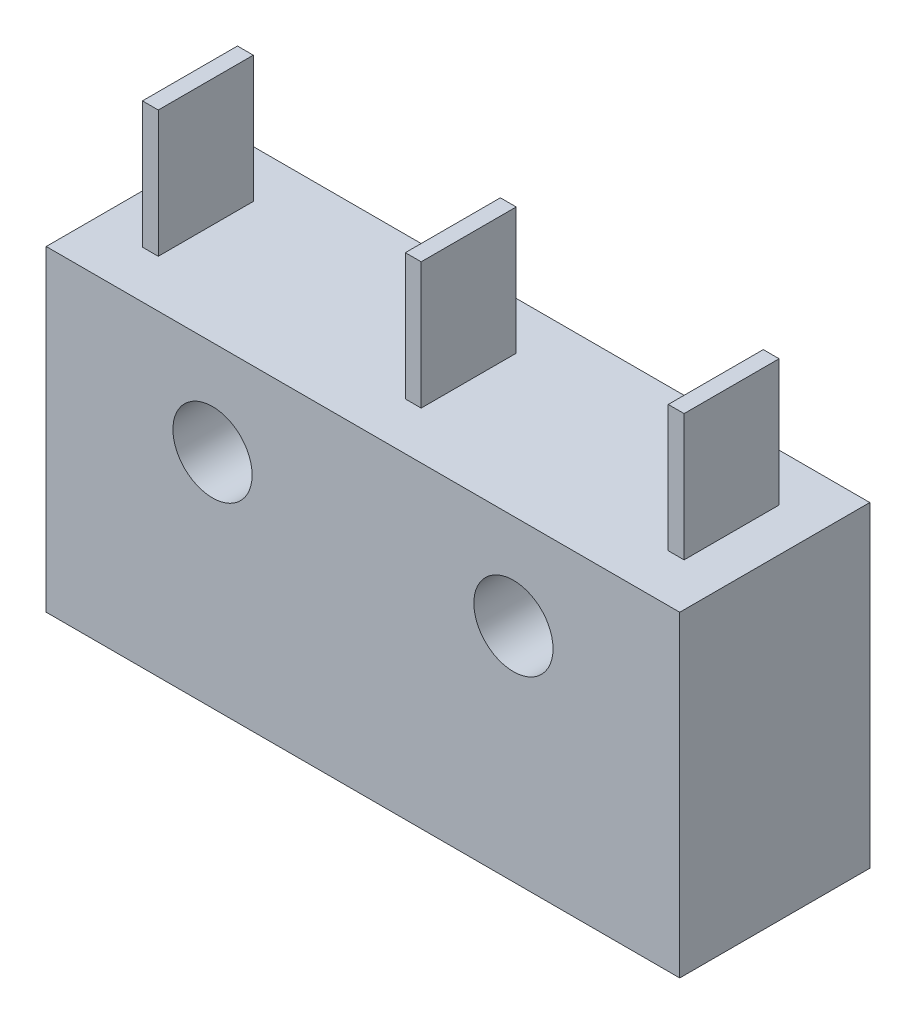
from build123d import *

# Parameters (mm, degrees)
SKETCH1_W           = 20
SKETCH1_H           = 10
BOSS_EXTRUDE1_DEPTH = 6
SKETCH2_W           = 0.5
SKETCH2_H           = 3
BOSS_EXTRUDE2_DEPTH = 4
SKETCH3_R           = 1.25
CUT_EXTRUDE1_DEPTH  = 15.730919863


with BuildPart() as part:
    # Sketch1 → Boss-Extrude1 (new body)
    with BuildSketch(Plane.XY):
        Rectangle(SKETCH1_W, SKETCH1_H)
    extrude(amount=BOSS_EXTRUDE1_DEPTH)

    # Sketch2 → Boss-Extrude2 (add)
    with BuildSketch(Plane(origin=(0, 5, 0), x_dir=(1, 0, 0), z_dir=(0, 1, 0))):
        with Locations((-8.212529155, -3)):
            Rectangle(SKETCH2_W, SKETCH2_H)
        with Locations((0.087470845, -3)):
            Rectangle(SKETCH2_W, SKETCH2_H)
        with Locations((8.387470845, -3)):
            Rectangle(SKETCH2_W, SKETCH2_H)
    extrude(amount=BOSS_EXTRUDE2_DEPTH)

    # Sketch3 → Cut-Extrude1 (cut, through all)
    with BuildSketch(Plane.XY.offset(6)):
        with Locations((-4.75, 2)):
            Circle(SKETCH3_R)
        with Locations((4.75, 2)):
            Circle(SKETCH3_R)
    extrude(amount=-CUT_EXTRUDE1_DEPTH, mode=Mode.SUBTRACT)


solid = part.part
